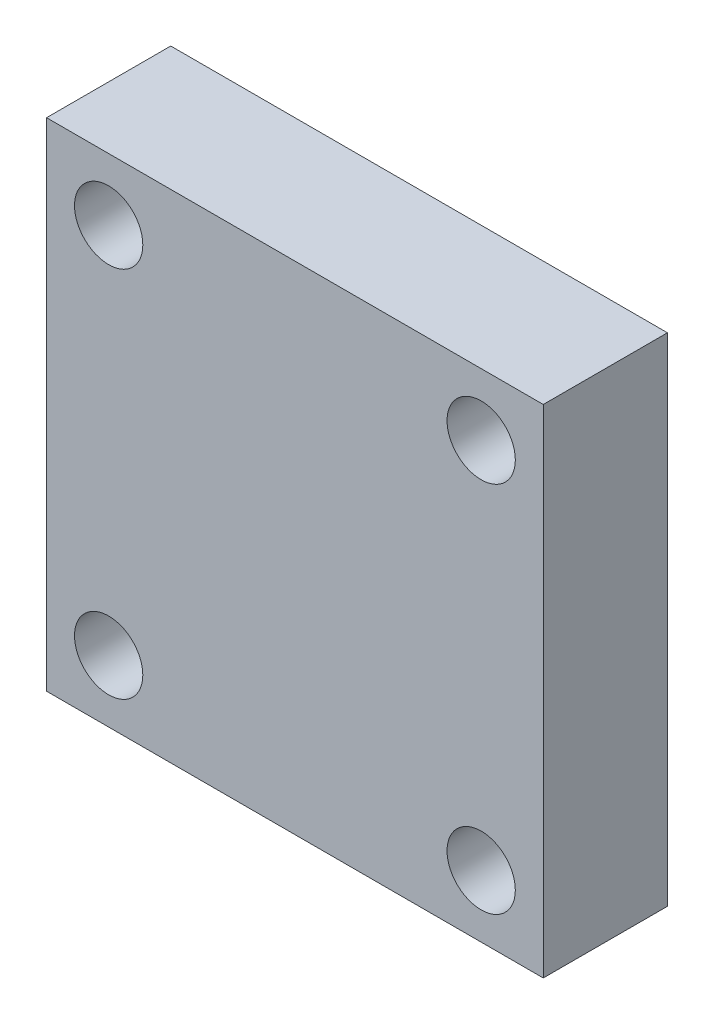
from build123d import *

# Parameters (mm, degrees)
SKETCH_1_W      = 40
SKETCH_1_H      = 40
SKETCH_1_R      = 2.75
EXTRUDE_1_DEPTH = 10


with BuildPart() as part:
    # Эскиз1 → Бобышка-Вытянуть1 (new body)
    with BuildSketch(Plane.XY):
        Rectangle(SKETCH_1_W, SKETCH_1_H)
        with Locations((-15, -15)):
            Circle(SKETCH_1_R, mode=Mode.SUBTRACT)
        with Locations((15, -15)):
            Circle(SKETCH_1_R, mode=Mode.SUBTRACT)
        with Locations((15, 15)):
            Circle(SKETCH_1_R, mode=Mode.SUBTRACT)
        with Locations((-15, 15)):
            Circle(SKETCH_1_R, mode=Mode.SUBTRACT)
    extrude(amount=EXTRUDE_1_DEPTH)


solid = part.part
